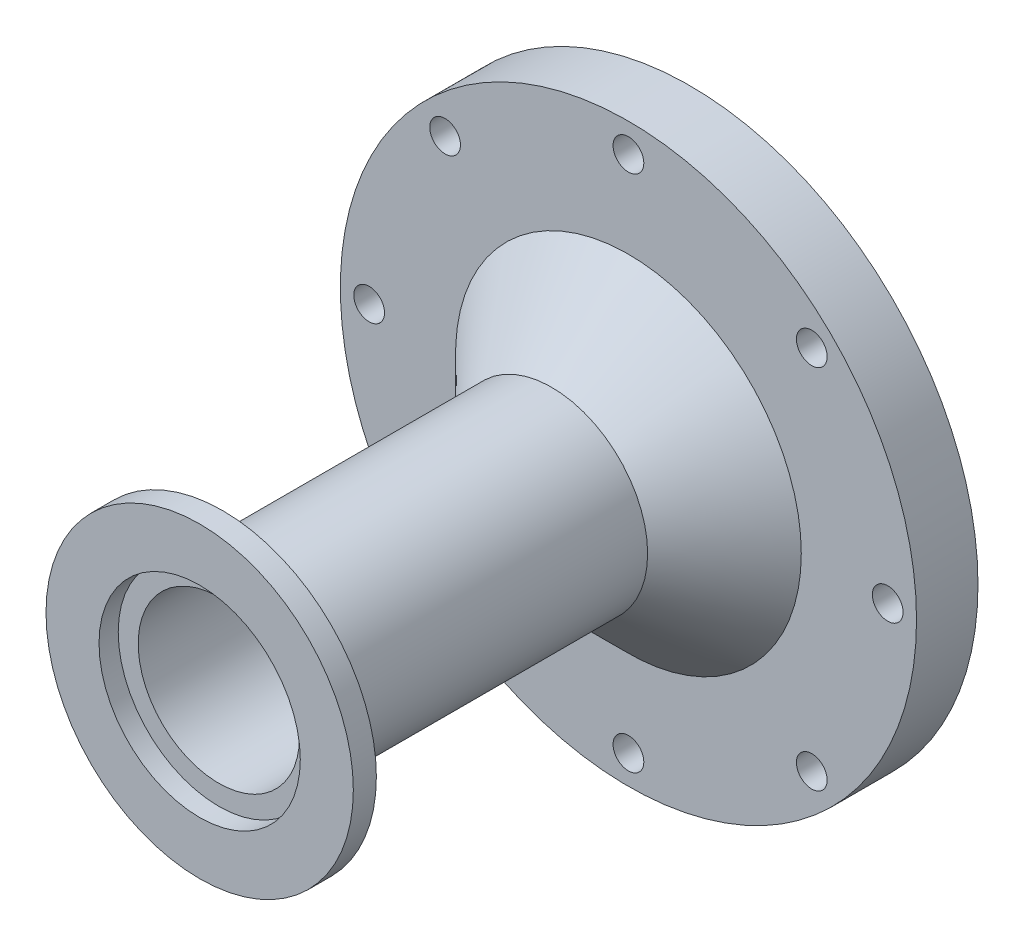
from build123d import *

# Parameters (mm, degrees)
SKETCH2_R           = 37.5
SKETCH2_R_2         = 5.35
BOSS_EXTRUDE2_DEPTH = 8
SKETCH14_R          = 2
CUT_EXTRUDE6_DEPTH  = 54.633012222
SKETCH3_R           = 20.71
SKETCH3_R_2         = 19.21
CUT_EXTRUDE2_DEPTH  = 2
SKETCH7_R           = 12.5
SKETCH7_R_2         = 10.5
BOSS_EXTRUDE4_DEPTH = 50.8
SKETCH10_R          = 12.5
BOSS_EXTRUDE5_DEPTH = 2.01
BOSS_EXTRUDE5_DRAFT = -75
SKETCH11_R          = 10.5
CUT_EXTRUDE3_DEPTH  = 81.686777727
BOSS_EXTRUDE6_START = 3
SKETCH12_R          = 20.001422123
SKETCH12_R_2        = 10.5
BOSS_EXTRUDE6_DEPTH = 3
SKETCH13_R          = 13.1
CUT_EXTRUDE4_DEPTH  = 2.5
CHAMFER1_SIZE       = 10


with BuildPart() as part:
    # Sketch2 → Boss-Extrude2 (new body)
    with BuildSketch(Plane.XY):
        Circle(SKETCH2_R)
        Circle(SKETCH2_R_2, mode=Mode.SUBTRACT)
    extrude(amount=BOSS_EXTRUDE2_DEPTH)

    # Sketch14 → Cut-Extrude6 (cut, through all)
    with BuildSketch(Plane.XY):
        with Locations((0, 33.75)):
            Circle(SKETCH14_R)
        with Locations((-23.864853865, 23.864853865)):
            Circle(SKETCH14_R)
        with Locations((-33.75, 0)):
            Circle(SKETCH14_R)
        with Locations((-23.864853865, -23.864853865)):
            Circle(SKETCH14_R)
        with Locations((0, -33.75)):
            Circle(SKETCH14_R)
        with Locations((23.864853865, -23.864853865)):
            Circle(SKETCH14_R)
        with Locations((33.75, 0)):
            Circle(SKETCH14_R)
        with Locations((23.864853865, 23.864853865)):
            Circle(SKETCH14_R)
    extrude(amount=CUT_EXTRUDE6_DEPTH, mode=Mode.SUBTRACT)

    # Sketch3 → Cut-Extrude2 (cut)
    with BuildSketch(Plane.XY):
        Circle(SKETCH3_R)
        Circle(SKETCH3_R_2, mode=Mode.SUBTRACT)
    extrude(amount=CUT_EXTRUDE2_DEPTH, mode=Mode.SUBTRACT)

    # Sketch7 → Boss-Extrude4 (add)
    with BuildSketch(Plane.XY.offset(8)):
        Circle(SKETCH7_R)
        Circle(SKETCH7_R_2, mode=Mode.SUBTRACT)
    extrude(amount=BOSS_EXTRUDE4_DEPTH)


with BuildPart() as boss_extrude5_tool:
    # Sketch10 → Boss-Extrude5 (with draft: the straight prism first)
    with BuildSketch(Plane.XY.offset(58.8)):
        Circle(SKETCH10_R)
    extrude(amount=BOSS_EXTRUDE5_DEPTH)
    # Boss-Extrude5: the draft: its side faces are tilted about the plane it starts from
    boss_extrude5_sides = [boss_extrude5_tool.faces().sort_by_distance(p)[0] for p in [
        (-12.5, 0, 59.805),
    ]]
    draft(boss_extrude5_sides, Plane.XY.offset(58.8), BOSS_EXTRUDE5_DRAFT)


with BuildPart() as part_1:
    add(part.part)

    # Boss-Extrude5: add boss_extrude5_tool
    add(boss_extrude5_tool.part)

    # Sketch11 → Cut-Extrude3 (cut, through all)
    with BuildSketch(Plane.XY.offset(60.81)):
        Circle(SKETCH11_R)
    extrude(amount=-CUT_EXTRUDE3_DEPTH, mode=Mode.SUBTRACT)

    # Sketch12 → Boss-Extrude6 (add)
    with BuildSketch(Plane.XY.offset(60.81).offset(BOSS_EXTRUDE6_START)):
        Circle(SKETCH12_R)
        Circle(SKETCH12_R_2, mode=Mode.SUBTRACT)
    extrude(amount=-BOSS_EXTRUDE6_DEPTH)

    # Sketch13 → Cut-Extrude4 (cut)
    with BuildSketch(Plane.XY.offset(63.81)):
        Circle(SKETCH13_R)
    extrude(amount=-CUT_EXTRUDE4_DEPTH, mode=Mode.SUBTRACT)

    # Chamfer1
    chamfer1_edges = [part_1.edges().sort_by_distance(p)[0] for p in [
        (-12.5, 0, 8),
    ]]
    chamfer(chamfer1_edges, length=CHAMFER1_SIZE)


solid = part_1.part
